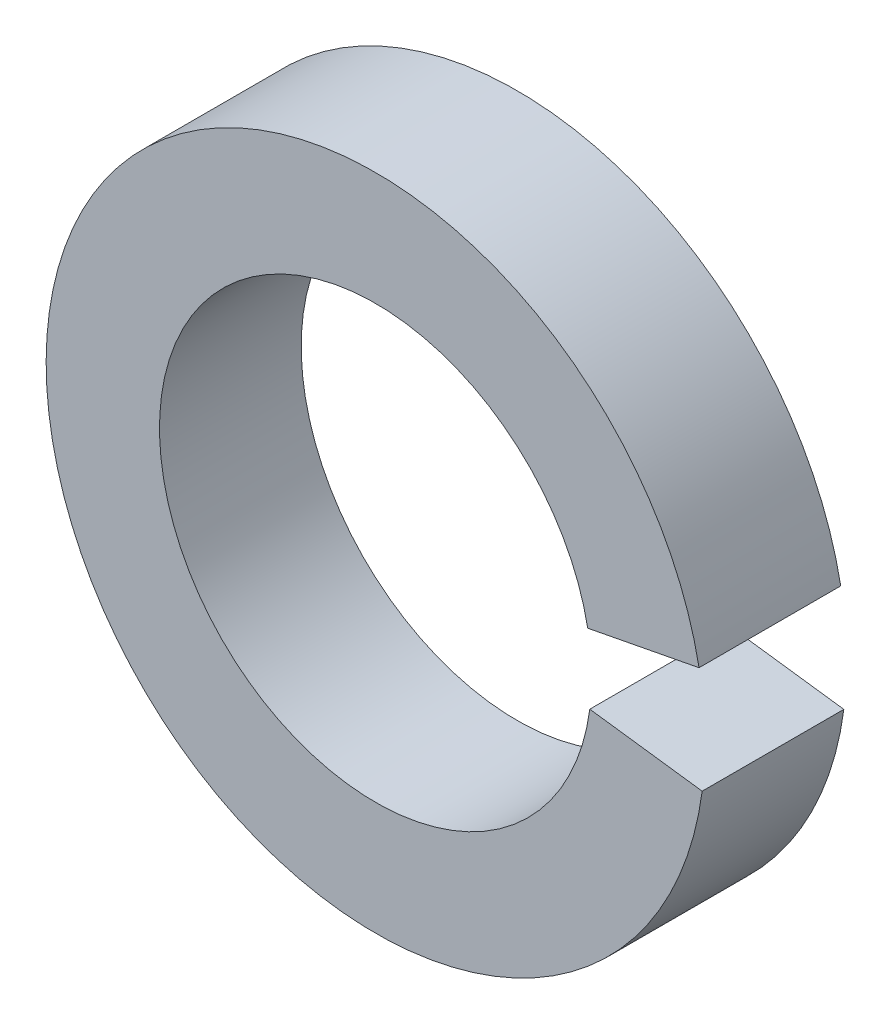
from build123d import *

# Parameters (mm, degrees)
EXTRUDE_1_DEPTH = 2


with BuildPart() as part:
    # 草图1 → 凸台-拉伸1 (new body)
    with BuildSketch(Plane.XY):
        with BuildLine():
            Line((2.994980148, 0.576709555), (4.566117276, 0.879245714))
            ThreePointArc((4.566117276, 0.879245714), (-4.647965071, -0.137552545), (4.610121651, -0.607682783))
            Line((4.610121651, -0.607682783), (3.023843233, -0.398587632))
            ThreePointArc((3.023843233, -0.398587632), (-3.048665261, -0.090222637), (2.994980148, 0.576709555))
        make_face()
    extrude(amount=EXTRUDE_1_DEPTH)


solid = part.part
